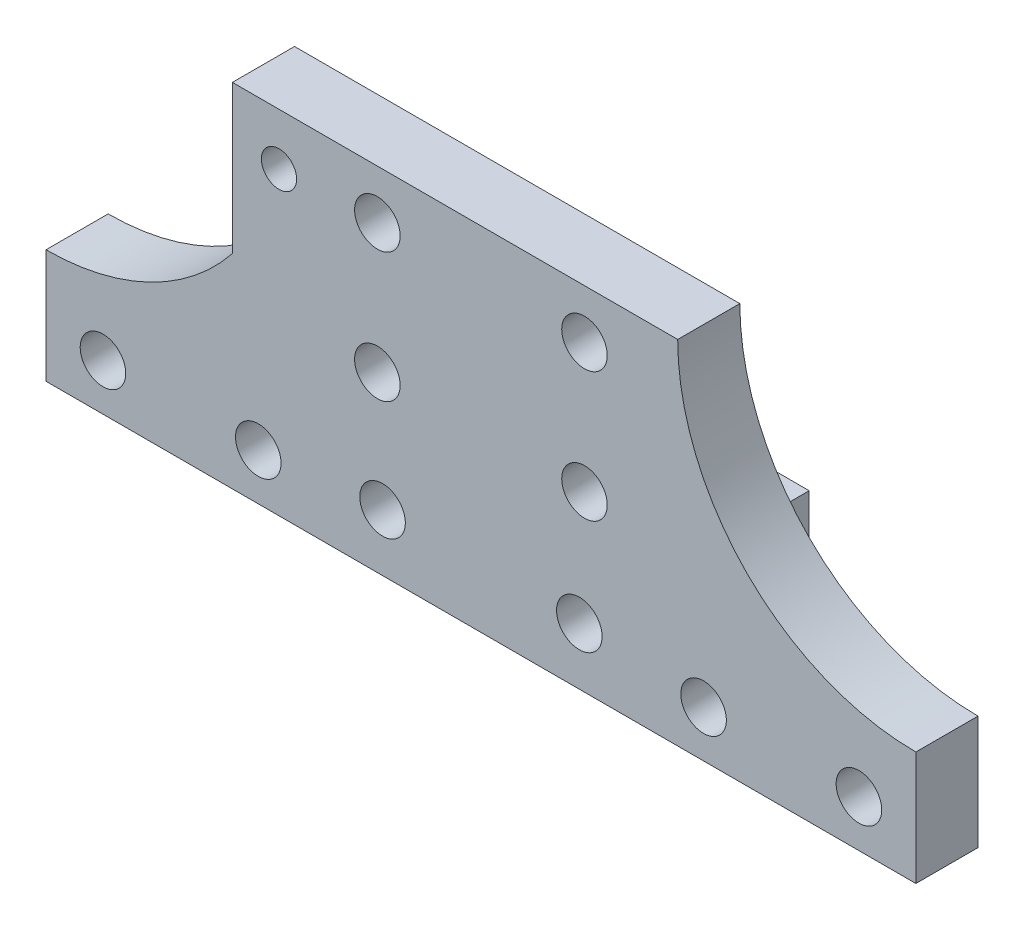
from build123d import *

# Parameters (mm, degrees)
SKETCH1_W           = 84
SKETCH1_H           = 34
BOSS_EXTRUDE1_DEPTH = 6
CUT_EXTRUDE1_DEPTH  = 75.823124768
SKETCH3_W           = 30
SKETCH3_H           = 11
BOSS_EXTRUDE2_DEPTH = 10.7
HOLE1_D             = 3.4
HOLE2_D             = 46
HOLE3_D             = 4.4
HOLE4_D             = 4.4
HOLE5_D             = 4.4
HOLE6_D             = 4.4
HOLE7_D             = 4.4
HOLE8_D             = 4.4
HOLE9_D             = 4.4
HOLE10_D            = 4.4
HOLE11_D            = 4.4
HOLE12_D            = 4.4
HOLE13_D            = 8
HOLE13_DEPTH        = 34
RIB1_REACH          = 59.09
SKETCH30_WALL_W     = 140.135684292
SKETCH30_WALL_H     = 5


with BuildPart() as part:
    # Sketch1 → Boss-Extrude1 (new body)
    with BuildSketch(Plane(origin=(0, 0, -14.3), x_dir=(-1, 0, 0), z_dir=(0, 0, -1))):
        with Locations((26.5, 12.5)):
            Rectangle(SKETCH1_W, SKETCH1_H)
    extrude(amount=-BOSS_EXTRUDE1_DEPTH)

    # Sketch2 → Cut-Extrude1 (cut, through all)
    with BuildSketch(Plane.XY.offset(-8.3)):
        with BuildLine():
            Line((-68.5, 29.5), (-68.5, 6.5))
            ThreePointArc((-68.5, 6.5), (-58.507750115, 8.78394482), (-50.5, 15.182178937))
            Line((-50.5, 15.182178937), (-50.5, 29.5))
            Line((-50.5, 29.5), (-68.5, 29.5))
        make_face()
    extrude(amount=-CUT_EXTRUDE1_DEPTH, mode=Mode.SUBTRACT)

    # Sketch3 → Boss-Extrude2 (add)
    with BuildSketch(Plane(origin=(0, 0, -14.3), x_dir=(-1, 0, 0), z_dir=(0, 0, -1))):
        with Locations((26.5, 1)):
            Rectangle(SKETCH3_W, SKETCH3_H)
    extrude(amount=BOSS_EXTRUDE2_DEPTH)

    # Hole1 (through all)
    with Locations(Plane(origin=(0, 0, -14.3), x_dir=(-1, 0, 0), z_dir=(0, 0, -1))):
        with Locations((46, 24.5)):
            Hole(HOLE1_D / 2)

    # Hole2 (through all)
    with Locations(Plane(origin=(0, 0, -14.3), x_dir=(-1, 0, 0), z_dir=(0, 0, -1))):
        with Locations((-15.5, 29.5)):
            Hole(HOLE2_D / 2)

    # Hole3 (through all)
    with Locations(Plane(origin=(0, 0, -14.3), x_dir=(-1, 0, 0), z_dir=(0, 0, -1))):
        with Locations((16.5, 12.25)):
            Hole(HOLE3_D / 2)

    # Hole4 (through all)
    with Locations(Plane(origin=(0, 0, -14.3), x_dir=(-1, 0, 0), z_dir=(0, 0, -1))):
        with Locations((36.5, 12.25)):
            Hole(HOLE4_D / 2)

    # Hole5 (through all)
    with Locations(Plane(origin=(0, 0, -14.3), x_dir=(-1, 0, 0), z_dir=(0, 0, -1))):
        with Locations((36.5, 24.75)):
            Hole(HOLE5_D / 2)

    # Hole6 (through all)
    with Locations(Plane(origin=(0, 0, -14.3), x_dir=(-1, 0, 0), z_dir=(0, 0, -1))):
        with Locations((16.5, 24.75)):
            Hole(HOLE6_D / 2)

    # Hole7 (through all)
    with Locations(Plane(origin=(0, 0, -25), x_dir=(-1, 0, 0), z_dir=(0, 0, -1))):
        with Locations((36, 1)):
            Hole(HOLE7_D / 2)

    # Hole8 (through all)
    with Locations(Plane(origin=(0, 0, -14.3), x_dir=(-1, 0, 0), z_dir=(0, 0, -1))):
        with Locations((48, 0)):
            Hole(HOLE8_D / 2)

    # Hole9 (through all)
    with Locations(Plane(origin=(0, 0, -14.3), x_dir=(-1, 0, 0), z_dir=(0, 0, -1))):
        with Locations((63, 0)):
            Hole(HOLE9_D / 2)

    # Hole10 (through all)
    with Locations(Plane.XY.offset(-8.3)):
        with Locations((-17, 1)):
            Hole(HOLE10_D / 2)

    # Hole11 (through all)
    with Locations(Plane(origin=(0, 0, -14.3), x_dir=(-1, 0, 0), z_dir=(0, 0, -1))):
        with Locations((5, 0)):
            Hole(HOLE11_D / 2)

    # Hole12 (through all)
    with Locations(Plane(origin=(0, 0, -14.3), x_dir=(-1, 0, 0), z_dir=(0, 0, -1))):
        with Locations((-10, 0)):
            Hole(HOLE12_D / 2)

    # Hole13
    with Locations(Plane.XZ.offset(4.5)):
        with Locations((-26.5, -25)):
            Hole(HOLE13_D / 2, depth=HOLE13_DEPTH)

    # Sketch30 wall → Rib1 (add, up to next)
    with BuildSketch(Plane(origin=(-26.5, 18, -17.65), x_dir=(0, -0.960093451224, -0.279679396661), z_dir=(0, -0.279679396661, 0.960093451224)), mode=Mode.PRIVATE) as rib1_sk1:
        Rectangle(SKETCH30_WALL_W, SKETCH30_WALL_H)
    rib1_tool1 = extrude(rib1_sk1.sketch, amount=RIB1_REACH, mode=Mode.PRIVATE) - part.part
    add(rib1_tool1.solids().sort_by_distance((-26.5, 18, -17.65))[0])


solid = part.part
